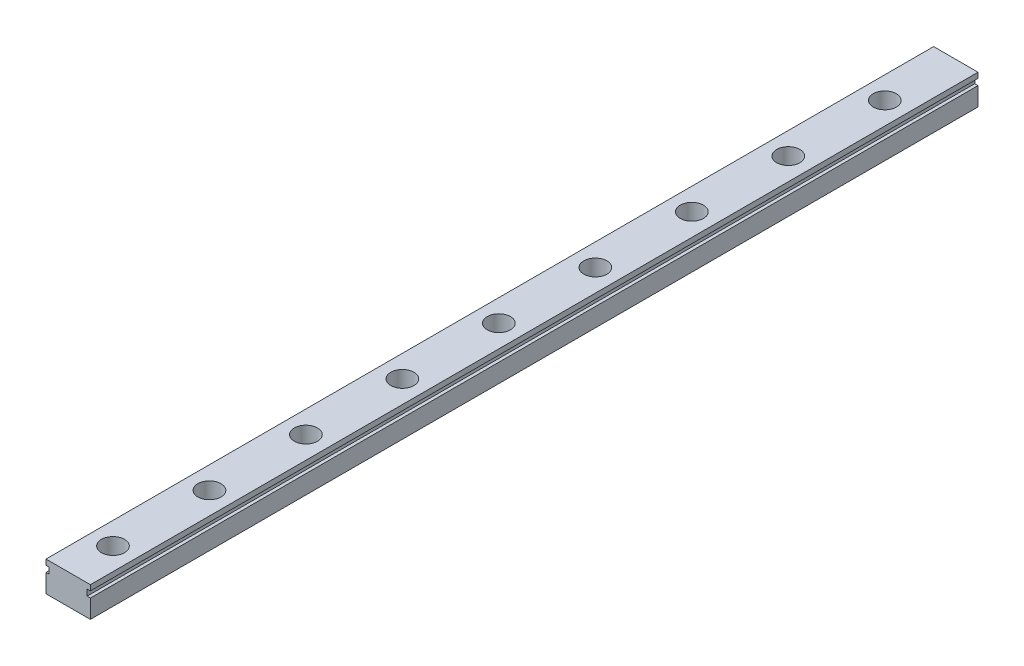
from build123d import *

# Parameters (mm, degrees)
SKETCH1_W           = 11.5
SKETCH1_H           = 7.8
BOSS_EXTRUDE1_DEPTH = 230
SKETCH2_W           = 0.835250229
SKETCH2_H           = 1.6
CUT_EXTRUDE1_DEPTH  = 231.104916288
SKETCH3_R           = 3
CUT_EXTRUDE2_DEPTH  = 4.7
SKETCH4_R           = 1.7
CUT_EXTRUDE3_DEPTH  = 231.119865505


with BuildPart() as part:
    # Sketch1 → Boss-Extrude1 (new body)
    with BuildSketch(Plane.XY):
        Rectangle(SKETCH1_W, SKETCH1_H)
    extrude(amount=BOSS_EXTRUDE1_DEPTH)

    # Sketch2 → Cut-Extrude1 (cut, through all)
    with BuildSketch(Plane.XY.offset(230)):
        with Locations((5.332374886, 1.7)):
            Rectangle(SKETCH2_W, SKETCH2_H)
        with Locations((-5.332374886, 1.7)):
            Rectangle(SKETCH2_W, SKETCH2_H)
    extrude(amount=-CUT_EXTRUDE1_DEPTH, mode=Mode.SUBTRACT)

    # Sketch3 → Cut-Extrude2 (cut)
    with BuildSketch(Plane(origin=(0, 3.9, 0), x_dir=(1, 0, 0), z_dir=(0, 1, 0))):
        with Locations(Location((0, -218.4, 0), (0, 0, 270))):
            Circle(SKETCH3_R)
        with Locations(Location((0, -193.4, 0), (0, 0, 270))):
            Circle(SKETCH3_R)
        with Locations(Location((0, -168.4, 0), (0, 0, 270))):
            Circle(SKETCH3_R)
        with Locations(Location((0, -143.4, 0), (0, 0, 270))):
            Circle(SKETCH3_R)
        with Locations(Location((0, -118.4, 0), (0, 0, 270))):
            Circle(SKETCH3_R)
        with Locations(Location((0, -93.4, 0), (0, 0, 270))):
            Circle(SKETCH3_R)
        with Locations(Location((0, -68.4, 0), (0, 0, 270))):
            Circle(SKETCH3_R)
        with Locations(Location((0, -43.4, 0), (0, 0, 270))):
            Circle(SKETCH3_R)
        with Locations(Location((0, -18.4, 0), (0, 0, 270))):
            Circle(SKETCH3_R)
        with Locations((0, 6.6)):
            Circle(SKETCH3_R)
        with Locations((0, 31.6)):
            Circle(SKETCH3_R)
        with Locations((0, 56.6)):
            Circle(SKETCH3_R)
        with Locations((0, 81.6)):
            Circle(SKETCH3_R)
        with Locations((0, 106.6)):
            Circle(SKETCH3_R)
        with Locations((0, 131.6)):
            Circle(SKETCH3_R)
        with Locations((0, 156.6)):
            Circle(SKETCH3_R)
        with Locations((0, 181.6)):
            Circle(SKETCH3_R)
        with Locations((0, 206.6)):
            Circle(SKETCH3_R)
        with Locations((0, 231.6)):
            Circle(SKETCH3_R)
        with Locations((0, 256.6)):
            Circle(SKETCH3_R)
        with Locations((0, 281.6)):
            Circle(SKETCH3_R)
        with Locations((0, 306.6)):
            Circle(SKETCH3_R)
        with Locations((0, 331.6)):
            Circle(SKETCH3_R)
        with Locations((0, 356.6)):
            Circle(SKETCH3_R)
        with Locations((0, 381.6)):
            Circle(SKETCH3_R)
    extrude(amount=-CUT_EXTRUDE2_DEPTH, mode=Mode.SUBTRACT)

    # Sketch4 → Cut-Extrude3 (cut, through all)
    with BuildSketch(Plane(origin=(0, -0.8, 0), x_dir=(1, 0, 0), z_dir=(0, 1, 0))):
        with Locations(Location((0, -218.4, 0), (0, 0, 270))):
            Circle(SKETCH4_R)
        with Locations(Location((0, -193.4, 0), (0, 0, 270))):
            Circle(SKETCH4_R)
        with Locations(Location((0, -168.4, 0), (0, 0, 270))):
            Circle(SKETCH4_R)
        with Locations(Location((0, -143.4, 0), (0, 0, 270))):
            Circle(SKETCH4_R)
        with Locations(Location((0, -118.4, 0), (0, 0, 270))):
            Circle(SKETCH4_R)
        with Locations(Location((0, -93.4, 0), (0, 0, 270))):
            Circle(SKETCH4_R)
        with Locations(Location((0, -68.4, 0), (0, 0, 270))):
            Circle(SKETCH4_R)
        with Locations(Location((0, -43.4, 0), (0, 0, 270))):
            Circle(SKETCH4_R)
        with Locations(Location((0, -18.4, 0), (0, 0, 270))):
            Circle(SKETCH4_R)
        with Locations((0, 6.6)):
            Circle(SKETCH4_R)
        with Locations((0, 31.6)):
            Circle(SKETCH4_R)
        with Locations((0, 56.6)):
            Circle(SKETCH4_R)
        with Locations((0, 81.6)):
            Circle(SKETCH4_R)
        with Locations((0, 106.6)):
            Circle(SKETCH4_R)
        with Locations((0, 131.6)):
            Circle(SKETCH4_R)
        with Locations((0, 156.6)):
            Circle(SKETCH4_R)
        with Locations((0, 181.6)):
            Circle(SKETCH4_R)
        with Locations((0, 206.6)):
            Circle(SKETCH4_R)
        with Locations((0, 231.6)):
            Circle(SKETCH4_R)
        with Locations((0, 256.6)):
            Circle(SKETCH4_R)
        with Locations((0, 281.6)):
            Circle(SKETCH4_R)
        with Locations((0, 306.6)):
            Circle(SKETCH4_R)
        with Locations((0, 331.6)):
            Circle(SKETCH4_R)
        with Locations((0, 356.6)):
            Circle(SKETCH4_R)
        with Locations((0, 381.6)):
            Circle(SKETCH4_R)
    extrude(amount=-CUT_EXTRUDE3_DEPTH, mode=Mode.SUBTRACT)


solid = part.part
